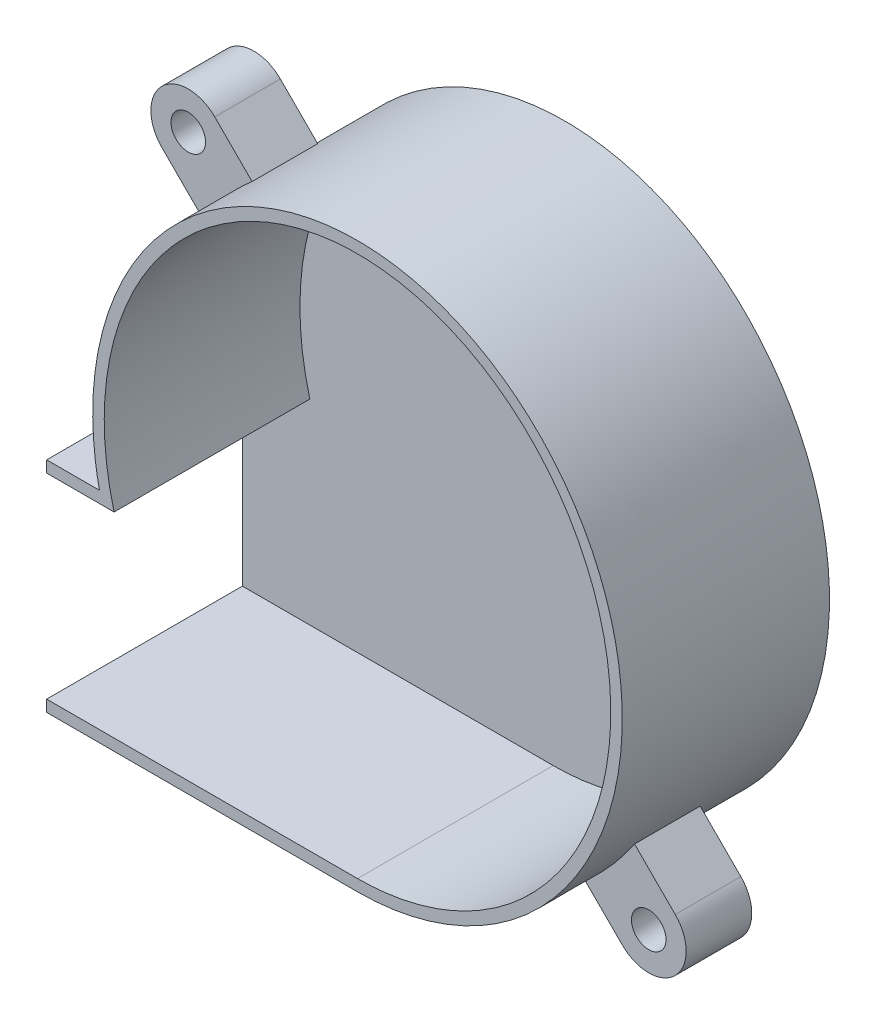
from build123d import *

# Parameters (mm, degrees)
RESSALTO_EXTRUS_O1_DEPTH = 1
RESSALTO_EXTRUS_O2_DEPTH = 18
RESSALTO_EXTRUS_O3_START = 7
ESBO_O2_R                = 1.5
RESSALTO_EXTRUS_O3_DEPTH = 5.7


with BuildPart() as part:
    # Esboço1 → Ressalto-extrusão1 (new body)
    with BuildSketch(Plane.XY):
        with BuildLine():
            Line((0, -24.5), (-27, -24.5))
            Line((-27, -24.5), (-27, -5.5))
            Line((-27, -5.5), (-22.412958113, -5.5))
            add(Edge.make_bspline(
                [(0, -24.5), (65.836852825, -24.5), (14.322096529, 19.170289513), (-37.192659768, 62.840579025), (-22.412958113, -5.5)],
                knots=[3.141592654, 3.141592654, 3.141592654, 5.610996862, 5.610996862, 8.080401071, 8.080401071, 8.080401071], degree=2, weights=[1, 0.329802368, 1, 0.329802368, 1]))
        make_face()
    extrude(amount=RESSALTO_EXTRUS_O1_DEPTH)

    # Esboço1<3> → Ressalto-extrusão2 (add)
    with BuildSketch(Plane.XY):
        with BuildLine():
            Line((-27, -24.5), (0, -24.5))
            add(Edge.make_bspline(
                [(0, -24.5), (65.836852825, -24.5), (14.322096529, 19.170289513), (-37.192659768, 62.840579025), (-22.412958113, -5.5)],
                knots=[3.141592654, 3.141592654, 3.141592654, 5.610996862, 5.610996862, 8.080401071, 8.080401071, 8.080401071], degree=2, weights=[1, 0.329802368, 1, 0.329802368, 1]))
            Line((-22.412958113, -5.5), (-27, -5.5))
            Line((-27, -5.5), (-27, -6.5))
            Line((-27, -6.5), (-26, -6.5))
            Line((-26, -6.5), (-21.141556032, -6.5))
            add(Edge.make_bspline(
                [(-21.141556032, -6.5), (-21.775904085, -4.146166632), (-22.350046066, 0.776913351), (-21.041148584, 8.085534263), (-17.693740565, 14.60325148), (-12.642011321, 19.698901502), (-6.382550613, 22.888421504), (0.481967819, 23.87642002), (7.300930311, 22.573109993), (13.42716626, 19.097124393), (18.269121458, 13.771519703), (21.349583792, 7.103813932), (22.360588572, -0.259019098), (21.200301949, -7.596472965), (17.985787778, -14.190737202), (13.037013627, -19.402563883), (6.845518309, -22.73606338), (2.276344903, -23.5), (0, -23.5)],
                knots=[-3.141592654, -3.141592654, -3.141592654, -3.141592654, -2.829596215, -2.517599777, -2.205603339, -1.893606901, -1.581610462, -1.269614024, -0.957617586, -0.645621148, -0.333624709, -0.021628271, 0.290368167, 0.602364606, 0.914361044, 1.226357482, 1.53835392, 1.850350359, 1.850350359, 1.850350359, 1.850350359], degree=3))
            Line((0, -23.5), (-26, -23.5))
            Line((-26, -23.5), (-27, -23.5))
            Line((-27, -23.5), (-27, -24.5))
        make_face()
    extrude(amount=RESSALTO_EXTRUS_O2_DEPTH)

    # Esboço2 → Ressalto-extrusão3 (add)
    # profile 1 of 2: a face of its own
    with BuildSketch(Plane.XY.offset(RESSALTO_EXTRUS_O3_START)):
        with BuildLine():
            Line((22.298097039, -17.701902961), (18.764191202, -14.167997125))
            add(Edge.make_bspline(
                [(14.457993873, -19.054187951), (16.927761984, -16.927761984), (18.764191202, -14.167997125)],
                knots=[3.821355278, 3.821355278, 3.821355278, 4.095763269, 4.095763269, 4.095763269], degree=2, weights=[1, 0.990602288, 1]))
            Line((14.457993873, -19.054187951), (17.701902961, -22.298097039))
            ThreePointArc((17.701902961, -22.298097039), (22.298097039, -22.298097039), (22.298097039, -17.701902961))
        make_face()
        with Locations((20, -20)):
            Circle(ESBO_O2_R, mode=Mode.SUBTRACT)
    # profile 2 of 2: a face of its own
    with BuildSketch(Plane.XY.offset(RESSALTO_EXTRUS_O3_START)):
        with BuildLine():
            Line((-14.457993873, 19.054187951), (-17.701902961, 22.298097039))
            ThreePointArc((-17.701902961, 22.298097039), (-22.298097039, 22.298097039), (-22.298097039, 17.701902961))
            Line((-22.298097039, 17.701902961), (-18.764191202, 14.167997125))
            add(Edge.make_bspline(
                [(-14.457993873, 19.054187951), (-16.927761984, 16.927761984), (-18.764191202, 14.167997125)],
                knots=[0.679762624, 0.679762624, 0.679762624, 0.954170616, 0.954170616, 0.954170616], degree=2, weights=[1, 0.990602288, 1]))
        make_face()
        with Locations((-20, 20)):
            Circle(ESBO_O2_R, mode=Mode.SUBTRACT)
    extrude(amount=RESSALTO_EXTRUS_O3_DEPTH)


solid = part.part
